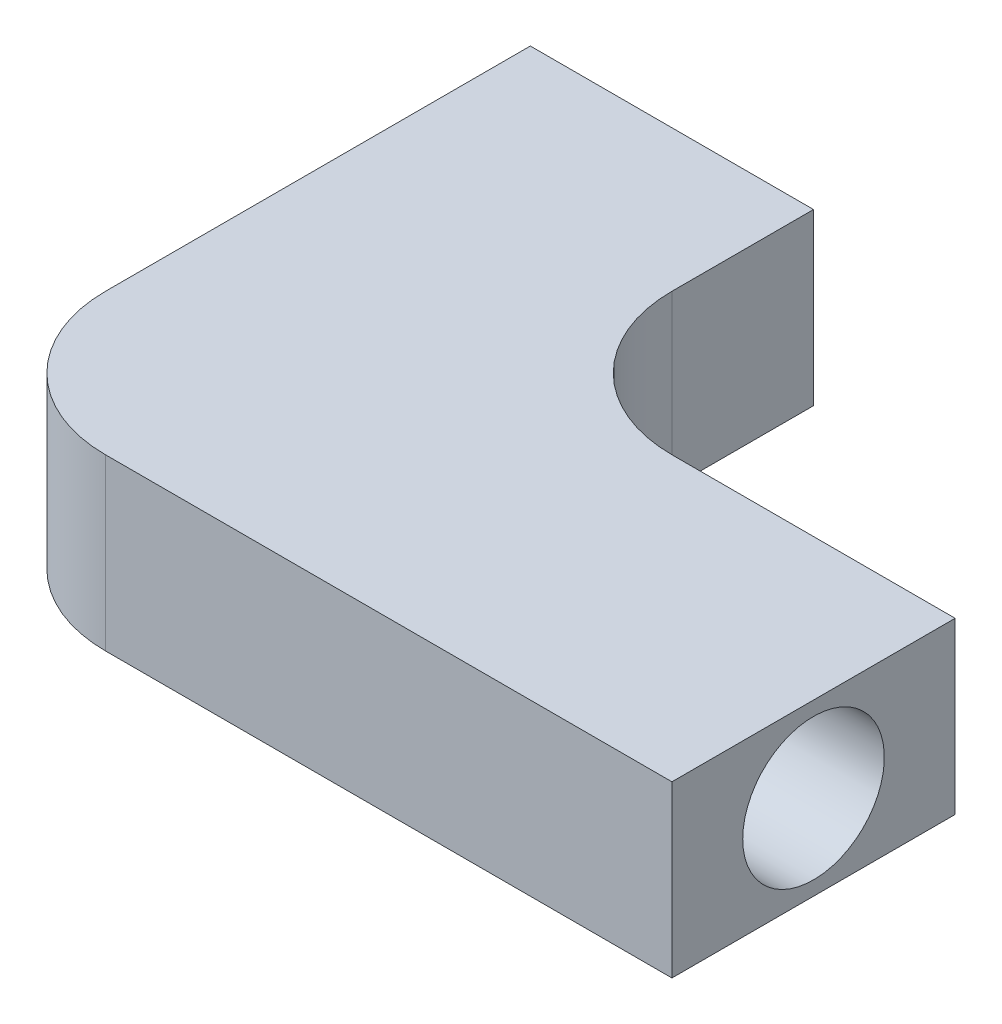
from build123d import *

# Parameters (mm, degrees)
EXTRUDE_1_DEPTH = 12
FILLET_2_R      = 10
SKETCH_2_R      = 5


with BuildPart() as part:
    # 草图1 → 凸台-拉伸1 (new body)
    with BuildSketch(Plane(origin=(0, 0, 0), x_dir=(1, 0, 0), z_dir=(0, 1, 0))):
        Polygon((0, 0), (0, -40), (50, -40), (50, -20), (20, -20), (20, 0), align=None)
    extrude(amount=EXTRUDE_1_DEPTH)

    # 圆角2
    fillet_2_edges = [part.edges().sort_by_distance(p)[0] for p in [
        (20, 6, 20),
        (0, 6, 40),
    ]]
    fillet(fillet_2_edges, radius=FILLET_2_R)

    # 切除-扫描1: sweep along a path in 草图4
    with BuildLine(Plane(origin=(0, 6, 0), x_dir=(-1, 0, 0), z_dir=(0, -1, 0))) as sweep_1_path:
        Line((-10, 3.270515342), (-10, -20))
        ThreePointArc((-10, -20), (-12.928932188, -27.071067812), (-20, -30))
        Line((-20, -30), (-53.042337367, -30))
    # 草图2 → 切除-扫描1 (sweep, cut)
    with BuildSketch(Plane(origin=(0, 0, 0), x_dir=(-1, 0, 0), z_dir=(0, 0, -1))):
        with Locations((-10, 6)):
            Circle(SKETCH_2_R)
    sweep(path=sweep_1_path.line, mode=Mode.SUBTRACT)


solid = part.part
